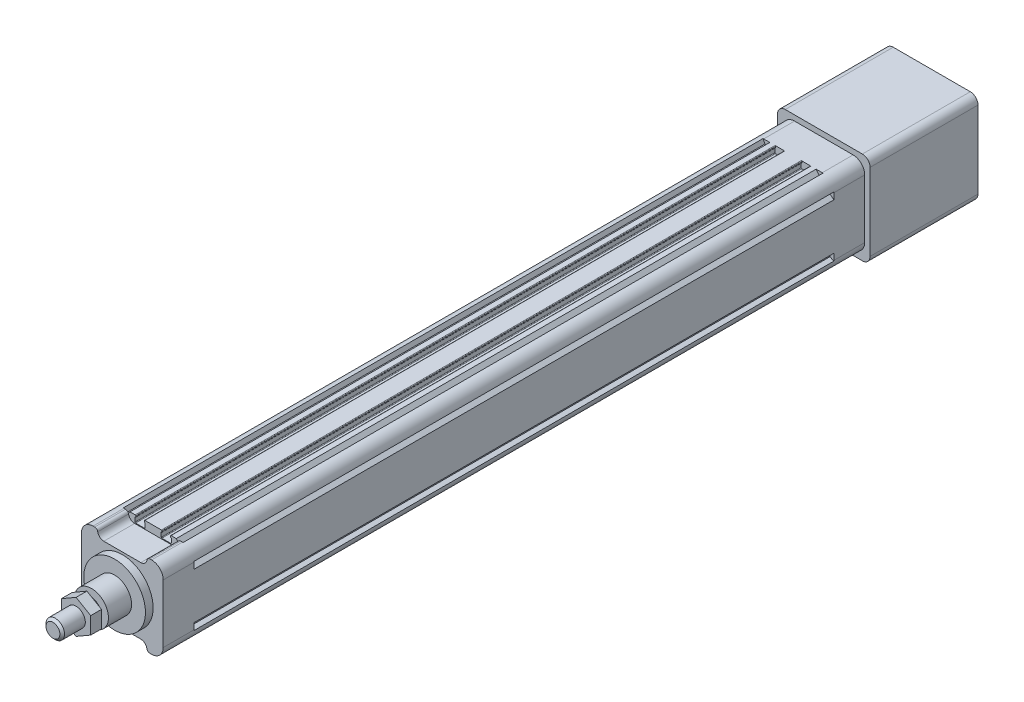
from build123d import *

# Parameters (mm, degrees)
SKETCH_1_R             = 2.1
EXTRUDE_1_DEPTH        = 415
EXTRUDE_2_DEPTH        = 20
SKETCH_7_R             = 20
EXTRUDE_3_DEPTH        = 5
SKETCH_9_R             = 11
EXTRUDE_4_DEPTH        = 15
SKETCH_10_R            = 6
EXTRUDE_5_DEPTH        = 25
EXTRUDE_START          = 20
EXTRUDE_6_DEPTH        = 20
EXTRUDE_7_DEPTH        = 70
SKETCH_14_R            = 19
CUT_EXTRUDE_2_DEPTH    = 70
HOLE_WIZARD_M6_1_D     = 5
HOLE_WIZARD_M6_1_DEPTH = 15
HOLE_WIZARD_M6_1_TIP   = 1.502151548
CHAMFER_1_SIZE         = 1.5
EXTRUDE_START_2        = 3
EXTRUDE_8_DEPTH        = 7


with BuildPart() as part:
    # 草图1 → 凸台-拉伸1 (new body)
    with BuildSketch(Plane.XY):
        with BuildLine():
            Line((-18.2, 24), (-19.443439638, 26.486879276))
            ThreePointArc((-19.443439638, 26.486879276), (-24.303300859, 24.303300859), (-26.486879276, 19.443439638))
            Line((-26.486879276, 19.443439638), (-24, 18.2))
            Line((-24, 18.2), (-24, 17.1))
            Line((-24, 17.1), (-26.5, 15))
            Line((-26.5, 15), (-26.5, -15))
            Line((-26.5, -15), (-24, -17.1))
            Line((-24, -17.1), (-24, -18.2))
            Line((-24, -18.2), (-26.486879276, -19.443439638))
            ThreePointArc((-26.486879276, -19.443439638), (-24.303300859, -24.303300859), (-19.443439638, -26.486879276))
            Line((-19.443439638, -26.486879276), (-18.2, -24))
            Line((-18.2, -24), (-17.1, -24))
            Line((-17.1, -24), (-15, -26.5))
            Line((-15, -26.5), (-11.65, -26.5))
            ThreePointArc((-11.65, -26.5), (-11.367157288, -26.382842712), (-11.25, -26.1))
            Line((-11.25, -26.1), (-11.25, -25.6))
            ThreePointArc((-11.25, -25.6), (-11.367157288, -25.317157288), (-11.65, -25.2))
            Line((-11.65, -25.2), (-11.75, -25.2))
            Line((-11.75, -25.2), (-11.75, -22.4))
            ThreePointArc((-11.75, -22.4), (-11.632842712, -22.117157288), (-11.35, -22))
            Line((-11.35, -22), (-5.65, -22))
            ThreePointArc((-5.65, -22), (-5.367157288, -22.117157288), (-5.25, -22.4))
            Line((-5.25, -22.4), (-5.25, -25.2))
            Line((-5.25, -25.2), (-5.35, -25.2))
            ThreePointArc((-5.35, -25.2), (-5.632842712, -25.317157288), (-5.75, -25.6))
            Line((-5.75, -25.6), (-5.75, -26.1))
            ThreePointArc((-5.75, -26.1), (-5.632842712, -26.382842712), (-5.35, -26.5))
            Line((-5.35, -26.5), (5.35, -26.5))
            ThreePointArc((5.35, -26.5), (5.632842712, -26.382842712), (5.75, -26.1))
            Line((5.75, -26.1), (5.75, -25.6))
            ThreePointArc((5.75, -25.6), (5.632842712, -25.317157288), (5.35, -25.2))
            Line((5.35, -25.2), (5.25, -25.2))
            Line((5.25, -25.2), (5.25, -22.4))
            ThreePointArc((5.25, -22.4), (5.367157288, -22.117157288), (5.65, -22))
            Line((5.65, -22), (11.35, -22))
            ThreePointArc((11.35, -22), (11.632842712, -22.117157288), (11.75, -22.4))
            Line((11.75, -22.4), (11.75, -25.2))
            Line((11.75, -25.2), (11.65, -25.2))
            ThreePointArc((11.65, -25.2), (11.367157288, -25.317157288), (11.25, -25.6))
            Line((11.25, -25.6), (11.25, -26.1))
            ThreePointArc((11.25, -26.1), (11.367157288, -26.382842712), (11.65, -26.5))
            Line((11.65, -26.5), (15, -26.5))
            Line((15, -26.5), (17.1, -24))
            Line((17.1, -24), (18.2, -24))
            Line((18.2, -24), (19.443439638, -26.486879276))
            ThreePointArc((19.443439638, -26.486879276), (24.303300859, -24.303300859), (26.486879276, -19.443439638))
            Line((26.486879276, -19.443439638), (24, -18.2))
            Line((24, -18.2), (24, -17.1))
            Line((24, -17.1), (26.5, -15))
            Line((26.5, -15), (26.5, 15))
            Line((26.5, 15), (24, 17.1))
            Line((24, 17.1), (24, 18.2))
            Line((24, 18.2), (26.486879276, 19.443439638))
            ThreePointArc((26.486879276, 19.443439638), (24.303300859, 24.303300859), (19.443439638, 26.486879276))
            Line((19.443439638, 26.486879276), (18.2, 24))
            Line((18.2, 24), (17.1, 24))
            Line((17.1, 24), (15, 26.5))
            Line((15, 26.5), (11.65, 26.5))
            ThreePointArc((11.65, 26.5), (11.367157288, 26.382842712), (11.25, 26.1))
            Line((11.25, 26.1), (11.25, 25.6))
            ThreePointArc((11.25, 25.6), (11.367157288, 25.317157288), (11.65, 25.2))
            Line((11.65, 25.2), (11.75, 25.2))
            Line((11.75, 25.2), (11.75, 22.4))
            ThreePointArc((11.75, 22.4), (11.632842712, 22.117157288), (11.35, 22))
            Line((11.35, 22), (5.65, 22))
            ThreePointArc((5.65, 22), (5.367157288, 22.117157288), (5.25, 22.4))
            Line((5.25, 22.4), (5.25, 25.2))
            Line((5.25, 25.2), (5.35, 25.2))
            ThreePointArc((5.35, 25.2), (5.632842712, 25.317157288), (5.75, 25.6))
            Line((5.75, 25.6), (5.75, 26.1))
            ThreePointArc((5.75, 26.1), (5.632842712, 26.382842712), (5.35, 26.5))
            Line((5.35, 26.5), (-5.35, 26.5))
            ThreePointArc((-5.35, 26.5), (-5.632842712, 26.382842712), (-5.75, 26.1))
            Line((-5.75, 26.1), (-5.75, 25.6))
            ThreePointArc((-5.75, 25.6), (-5.632842712, 25.317157288), (-5.35, 25.2))
            Line((-5.35, 25.2), (-5.25, 25.2))
            Line((-5.25, 25.2), (-5.25, 22.4))
            ThreePointArc((-5.25, 22.4), (-5.367157288, 22.117157288), (-5.65, 22))
            Line((-5.65, 22), (-11.35, 22))
            ThreePointArc((-11.35, 22), (-11.632842712, 22.117157288), (-11.75, 22.4))
            Line((-11.75, 22.4), (-11.75, 25.2))
            Line((-11.75, 25.2), (-11.65, 25.2))
            ThreePointArc((-11.65, 25.2), (-11.367157288, 25.317157288), (-11.25, 25.6))
            Line((-11.25, 25.6), (-11.25, 26.1))
            ThreePointArc((-11.25, 26.1), (-11.367157288, 26.382842712), (-11.65, 26.5))
            Line((-11.65, 26.5), (-15, 26.5))
            Line((-15, 26.5), (-17.1, 24))
            Line((-17.1, 24), (-18.2, 24))
        make_face()
        with Locations((19, 19)):
            Circle(SKETCH_1_R, mode=Mode.SUBTRACT)
        with Locations((19, -19)):
            Circle(SKETCH_1_R, mode=Mode.SUBTRACT)
        with Locations((-19, -19)):
            Circle(SKETCH_1_R, mode=Mode.SUBTRACT)
        with Locations((-19, 19)):
            Circle(SKETCH_1_R, mode=Mode.SUBTRACT)
        with BuildLine():
            Line((19.773719933, 3), (23.3, 3))
            Line((23.3, 3), (23.3, -3))
            Line((23.3, -3), (19.773719933, -3))
            ThreePointArc((19.773719933, -3), (0, -20), (-19.773719933, -3))
            Line((-19.773719933, -3), (-23.3, -3))
            Line((-23.3, -3), (-23.3, 3))
            Line((-23.3, 3), (-19.773719933, 3))
            ThreePointArc((-19.773719933, 3), (0, 20), (19.773719933, 3))
        make_face(mode=Mode.SUBTRACT)
    extrude(amount=EXTRUDE_1_DEPTH)

    # 草图6 → 凸台-拉伸2 (add)
    with BuildSketch(Plane.XY.offset(415)):
        with BuildLine():
            Line((-26.5, -19), (-26.5, 19))
            ThreePointArc((-26.5, 19), (-24.303300859, 24.303300859), (-19, 26.5))
            Line((-19, 26.5), (-17.916079783, 26.5))
            ThreePointArc((-17.916079783, 26.5), (-16.625085334, 26.027525232), (-15.944053189, 24.833333333))
            ThreePointArc((-15.944053189, 24.833333333), (-14.581988897, 22.444949537), (-12, 21.5))
            Line((-12, 21.5), (12, 21.5))
            ThreePointArc((12, 21.5), (14.581988897, 22.444949537), (15.944053189, 24.833333333))
            ThreePointArc((15.944053189, 24.833333333), (16.625085334, 26.027525232), (17.916079783, 26.5))
            Line((17.916079783, 26.5), (19, 26.5))
            ThreePointArc((19, 26.5), (24.303300859, 24.303300859), (26.5, 19))
            Line((26.5, 19), (26.5, -19))
            ThreePointArc((26.5, -19), (24.303300859, -24.303300859), (19, -26.5))
            Line((19, -26.5), (17.916079783, -26.5))
            ThreePointArc((17.916079783, -26.5), (16.625085334, -26.027525232), (15.944053189, -24.833333333))
            ThreePointArc((15.944053189, -24.833333333), (14.581988897, -22.444949537), (12, -21.5))
            Line((12, -21.5), (-12, -21.5))
            ThreePointArc((-12, -21.5), (-14.581988897, -22.444949537), (-15.944053189, -24.833333333))
            ThreePointArc((-15.944053189, -24.833333333), (-16.625085334, -26.027525232), (-17.916079783, -26.5))
            Line((-17.916079783, -26.5), (-19, -26.5))
            ThreePointArc((-19, -26.5), (-24.303300859, -24.303300859), (-26.5, -19))
        make_face()
    extrude(amount=EXTRUDE_2_DEPTH)

    # 草图7 → 凸台-拉伸3 (add)
    with BuildSketch(Plane.XY.offset(435)):
        Circle(SKETCH_7_R)
    extrude(amount=EXTRUDE_3_DEPTH)

    # 草图9 → 凸台-拉伸4 (add)
    with BuildSketch(Plane.XY.offset(440)):
        Circle(SKETCH_9_R)
    extrude(amount=EXTRUDE_4_DEPTH)

    # 草图10 → 凸台-拉伸5 (add)
    with BuildSketch(Plane.XY.offset(455)):
        Circle(SKETCH_10_R)
    extrude(amount=EXTRUDE_5_DEPTH)

    # 草图11 → 凸台-拉伸6 (add)
    with BuildSketch(Plane(origin=(0, 0, 0), x_dir=(-1, 0, 0), z_dir=(0, 0, -1)).offset(EXTRUDE_START)):
        with BuildLine():
            Line((-19, -26.5), (19, -26.5))
            ThreePointArc((19, -26.5), (24.303300859, -24.303300859), (26.5, -19))
            Line((26.5, -19), (26.5, 19))
            ThreePointArc((26.5, 19), (24.303300859, 24.303300859), (19, 26.5))
            Line((19, 26.5), (-19, 26.5))
            ThreePointArc((-19, 26.5), (-24.303300859, 24.303300859), (-26.5, 19))
            Line((-26.5, 19), (-26.5, -19))
            ThreePointArc((-26.5, -19), (-24.303300859, -24.303300859), (-19, -26.5))
        make_face()
    extrude(amount=-EXTRUDE_6_DEPTH)

    # 草图12 → 凸台-拉伸7 (add)
    with BuildSketch(Plane(origin=(0, 0, -20), x_dir=(-1, 0, 0), z_dir=(0, 0, -1))):
        with BuildLine():
            Line((-25, -30), (25, -30))
            ThreePointArc((25, -30), (28.535533906, -28.535533906), (30, -25))
            Line((30, -25), (30, 25))
            ThreePointArc((30, 25), (28.535533906, 28.535533906), (25, 30))
            Line((25, 30), (-25, 30))
            ThreePointArc((-25, 30), (-28.535533906, 28.535533906), (-30, 25))
            Line((-30, 25), (-30, -25))
            ThreePointArc((-30, -25), (-28.535533906, -28.535533906), (-25, -30))
        make_face()
    extrude(amount=EXTRUDE_7_DEPTH)

    # 草图14 → 切除-拉伸2 (cut)
    with BuildSketch(Plane(origin=(0, 0, -90), x_dir=(-1, 0, 0), z_dir=(0, 0, -1))):
        Circle(SKETCH_14_R)
    extrude(amount=-CUT_EXTRUDE_2_DEPTH, mode=Mode.SUBTRACT)

    # M6 螺纹孔1
    with Locations(Plane.ZY.offset(26.5)):
        with Locations((425, 11), (425, -11), (-10, 11), (-10, -11)):
            Hole(HOLE_WIZARD_M6_1_D / 2, depth=HOLE_WIZARD_M6_1_DEPTH)
            with Locations((0, 0, -(HOLE_WIZARD_M6_1_DEPTH + HOLE_WIZARD_M6_1_TIP / 2))):  # 118° drill point
                Cone(0, HOLE_WIZARD_M6_1_D / 2, HOLE_WIZARD_M6_1_TIP, mode=Mode.SUBTRACT)

    # 倒角1
    chamfer_1_edges = [part.edges().sort_by_distance(p)[0] for p in [
        (-6, 0, 480),
    ]]
    chamfer(chamfer_1_edges, length=CHAMFER_1_SIZE)

    # 草图17 → 凸台-拉伸8 (add)
    with BuildSketch(Plane.XY.offset(455).offset(EXTRUDE_START_2)):
        Polygon((0, 10.969655115), (-9.5, 5.484827557), (-9.5, -5.484827557), (0, -10.969655115), (9.5, -5.484827557), (9.5, 5.484827557), align=None)
    extrude(amount=EXTRUDE_8_DEPTH)


solid = part.part
